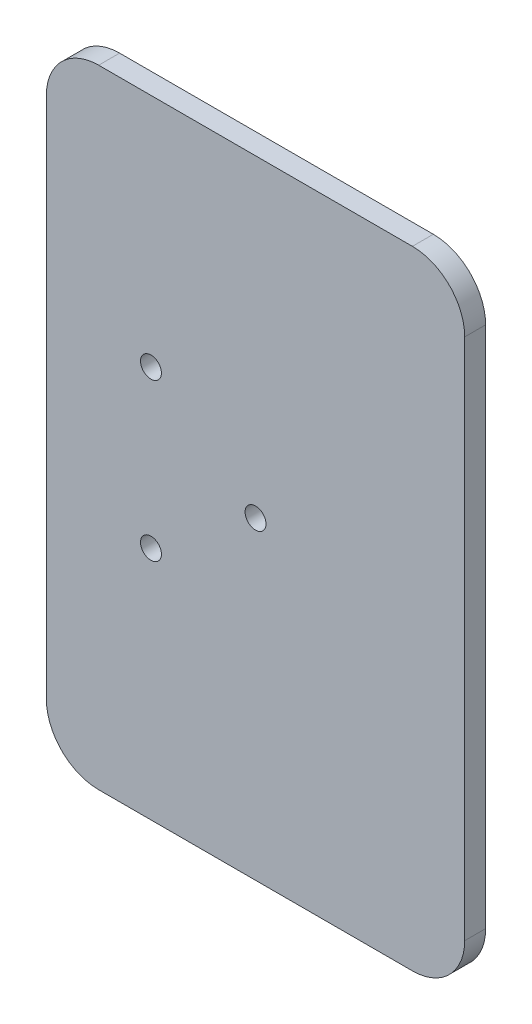
from build123d import *

# Parameters (mm, degrees)
SKETCH1_W               = 40
SKETCH1_H               = 60
BOSS_EXTRUDE4_DEPTH     = 2
FILLET1_R               = 5
SKETCH12_R              = 1
CUT_EXTRUDE6_DEPTH      = 12
CUT_EXTRUDE7_DEPTH      = 8
CUT_EXTRUDE7_DEPTH_BACK = 10
SKETCH13_R              = 1


with BuildPart() as part:
    # Sketch1 → Boss-Extrude4 (new body)
    with BuildSketch(Plane.XY):
        with Locations((-45.9850693, -3.193565597)):
            Rectangle(SKETCH1_W, SKETCH1_H)
    extrude(amount=-BOSS_EXTRUDE4_DEPTH)

    # Fillet1
    fillet1_edges = [part.edges().sort_by_distance(p)[0] for p in [
        (-65.9850693, 26.806434403, -1),
        (-65.9850693, -33.193565597, -1),
        (-25.9850693, -33.193565597, -1),
        (-25.9850693, 26.806434403, -1),
    ]]
    fillet(fillet1_edges, radius=FILLET1_R)

    # Sketch12 → Cut-Extrude6 (cut)
    with BuildSketch(Plane(origin=(0, 0, -2), x_dir=(-1, 0, 0), z_dir=(0, 0, -1))):
        with Locations((45.9850693, -3.193565597)):
            Circle(SKETCH12_R)
    extrude(amount=-CUT_EXTRUDE6_DEPTH, mode=Mode.SUBTRACT)

    # Sketch13 → Cut-Extrude7 (cut, two sides: drawn at the far end of the back side and taken through both)
    with BuildSketch(Plane(origin=(0, 0, -2), x_dir=(-1, 0, 0), z_dir=(0, 0, -1)).offset(-CUT_EXTRUDE7_DEPTH_BACK)):
        with Locations((55.9850693, 4.306434403)):
            Circle(SKETCH13_R)
        with Locations((55.9850693, -10.693565597)):
            Circle(SKETCH13_R)
    extrude(amount=CUT_EXTRUDE7_DEPTH + CUT_EXTRUDE7_DEPTH_BACK, mode=Mode.SUBTRACT)


solid = part.part
